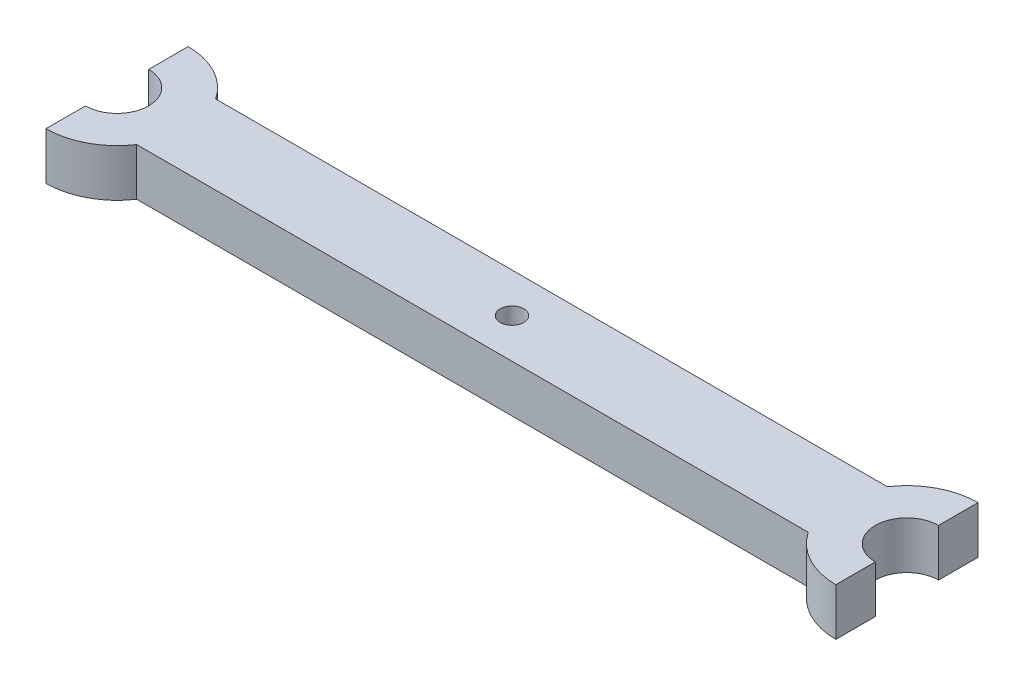
from build123d import *

# Parameters (mm, degrees)
BOSS_EXTRUDE1_DEPTH = 6
SKETCH2_R           = 1.5
CUT_EXTRUDE1_DEPTH  = 52.15662225


with BuildPart() as part:
    # Sketch1 → Boss-Extrude1 (new body)
    with BuildSketch(Plane(origin=(0, 0, 0), x_dir=(1, 0, 0), z_dir=(0, 1, 0))):
        with BuildLine():
            Line((-50, 4), (-50, 9))
            ThreePointArc((-50, 9), (-45.757359313, 7.937253933), (-42.516685226, 5))
            Line((-42.516685226, 5), (42.516685226, 5))
            ThreePointArc((42.516685226, 5), (45.757359313, 7.937253933), (50, 9))
            Line((50, 9), (50, 4))
            ThreePointArc((50, 4), (46, 0), (50, -4))
            Line((50, -4), (50, -9))
            ThreePointArc((50, -9), (45.757359313, -7.937253933), (42.516685226, -5))
            Line((42.516685226, -5), (-42.516685226, -5))
            ThreePointArc((-42.516685226, -5), (-45.757359313, -7.937253933), (-50, -9))
            Line((-50, -9), (-50, -4))
            ThreePointArc((-50, -4), (-46, 0), (-50, 4))
        make_face()
    extrude(amount=BOSS_EXTRUDE1_DEPTH)

    # Sketch2 → Cut-Extrude1 (cut, through all)
    with BuildSketch(Plane(origin=(0, 6, 0), x_dir=(1, 0, 0), z_dir=(0, 1, 0))):
        with Locations(Location((0, 0, 0), (0, 0, 270))):
            Circle(SKETCH2_R)
    extrude(amount=-CUT_EXTRUDE1_DEPTH, mode=Mode.SUBTRACT)


solid = part.part
